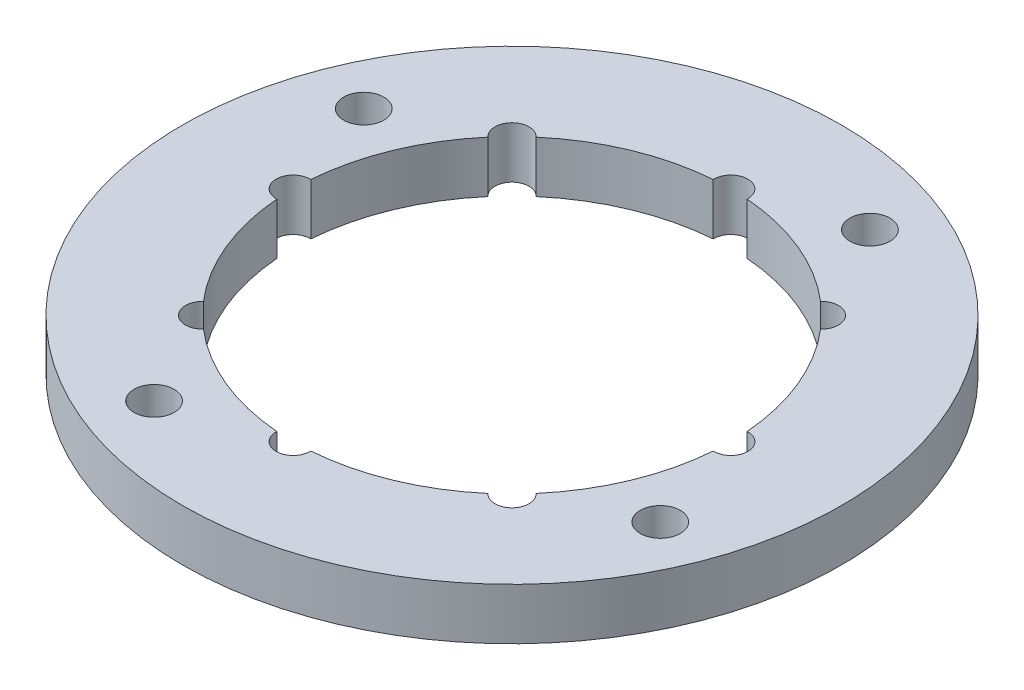
from build123d import *

# Parameters (mm, degrees)
F_1_5IN_SOCKET_R    = 40.64
F_1_5IN_SOCKET_R_2  = 2.475
BOSS_EXTRUDE1_DEPTH = 6.35


with BuildPart() as part:
    # 1.5in Socket → Boss-Extrude1 (new body)
    with BuildSketch(Plane(origin=(0, 0, 0), x_dir=(1, 0, 0), z_dir=(0, 1, 0))):
        with Locations(Location((0, 0, 0), (0, 0, 270))):
            Circle(F_1_5IN_SOCKET_R)
        with Locations(Location((12.927811712, 31.210498367, 0), (0, 0, 270))):
            Circle(F_1_5IN_SOCKET_R_2, mode=Mode.SUBTRACT)
        with Locations(Location((31.210498367, -12.927811712, 0), (0, 0, 270))):
            Circle(F_1_5IN_SOCKET_R_2, mode=Mode.SUBTRACT)
        with Locations(Location((-31.210498367, 12.927811712, 0), (0, 0, 270))):
            Circle(F_1_5IN_SOCKET_R_2, mode=Mode.SUBTRACT)
        with Locations(Location((-12.927811712, -31.210498367, 0), (0, 0, 270))):
            Circle(F_1_5IN_SOCKET_R_2, mode=Mode.SUBTRACT)
        with BuildLine():
            ThreePointArc((-20.506142942, 17.544892644), (-20.564786517, 20.564786517), (-17.544892644, 20.506142942))
            ThreePointArc((-17.544892644, 20.506142942), (-10.327669131, 24.933198884), (-2.093920166, 26.906145294))
            ThreePointArc((-2.093920166, 26.906145294), (0, 29.083), (2.093920166, 26.906145294))
            ThreePointArc((2.093920166, 26.906145294), (10.327669131, 24.933198884), (17.544892644, 20.506142942))
            ThreePointArc((17.544892644, 20.506142942), (20.564786517, 20.564786517), (20.506142942, 17.544892644))
            ThreePointArc((20.506142942, 17.544892644), (24.933198884, 10.327669131), (26.906145294, 2.093920166))
            ThreePointArc((26.906145294, 2.093920166), (29.083, 0), (26.906145294, -2.093920166))
            ThreePointArc((26.906145294, -2.093920166), (24.933198884, -10.327669131), (20.506142942, -17.544892644))
            ThreePointArc((20.506142942, -17.544892644), (20.564786517, -20.564786517), (17.544892644, -20.506142942))
            ThreePointArc((17.544892644, -20.506142942), (10.327669131, -24.933198884), (2.093920166, -26.906145294))
            ThreePointArc((2.093920166, -26.906145294), (0, -29.083), (-2.093920166, -26.906145294))
            ThreePointArc((-2.093920166, -26.906145294), (-10.327669131, -24.933198884), (-17.544892644, -20.506142942))
            ThreePointArc((-17.544892644, -20.506142942), (-20.564786517, -20.564786517), (-20.506142942, -17.544892644))
            ThreePointArc((-20.506142942, -17.544892644), (-24.933198884, -10.327669131), (-26.906145294, -2.093920166))
            ThreePointArc((-26.906145294, -2.093920166), (-29.083, 0), (-26.906145294, 2.093920166))
            ThreePointArc((-26.906145294, 2.093920166), (-24.933198884, 10.327669131), (-20.506142942, 17.544892644))
        make_face(mode=Mode.SUBTRACT)
    extrude(amount=BOSS_EXTRUDE1_DEPTH)


solid = part.part
